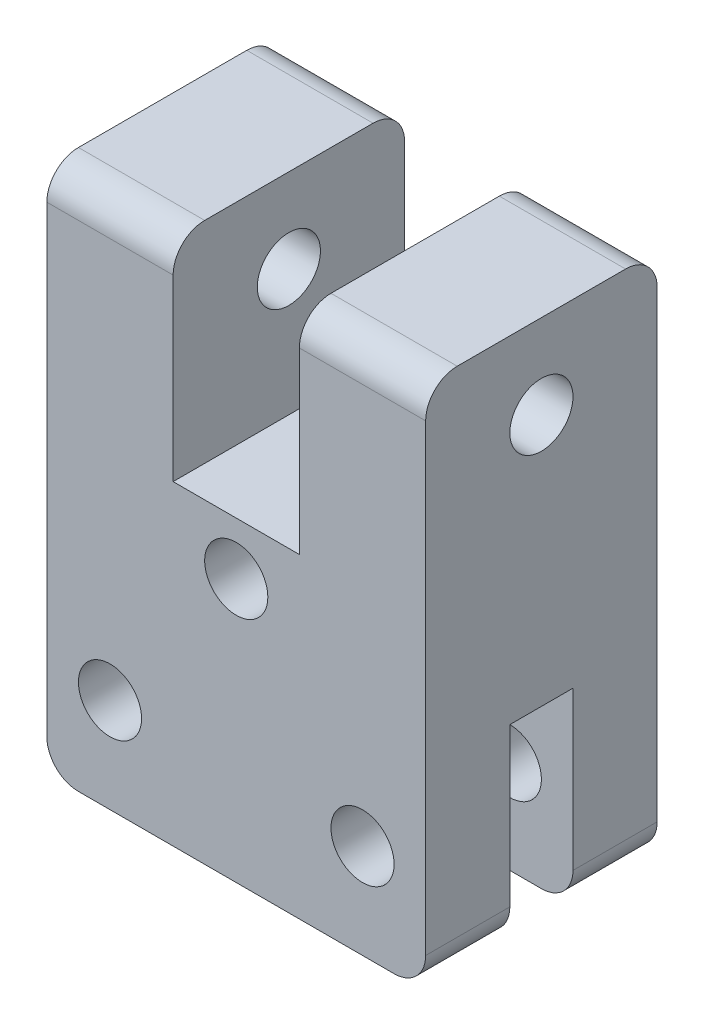
from build123d import *

# Parameters (mm, degrees)
CROQUIS2_W                 = 18
CROQUIS2_H                 = 15
SALIENTE_EXTRUIR1_DEPTH    = 5.5
CROQUIS3_W                 = 18
CROQUIS3_H                 = 9
CORTAR_EXTRUIR1_DEPTH      = 1.5
CORTAR_EXTRUIR2_DEPTH      = 13.942179106
CROQUIS10_W                = 6
CROQUIS10_H                = 11
SALIENTE_EXTRUIR4_DEPTH    = 10
CORTAR_EXTRUIR3_DEPTH      = 21.432816742
CORTAR_EXTRUIR3_DEPTH_BACK = 21.432816742
CROQUIS7_R                 = 1.5
CORTAR_EXTRUIR4_DEPTH      = 21.432816742
CORTAR_EXTRUIR4_DEPTH_BACK = 21.432816742
CROQUIS11_R                = 1.5
REDONDEO2_R                = 1.5
REDONDEO3_R                = 1.5
CROQUIS15_R                = 1.5
CORTAR_EXTRUIR7_DEPTH      = 10


with BuildPart() as part:
    # Croquis2 → Saliente-Extruir1 (new, symmetric)
    with BuildSketch(Plane.XY):
        Rectangle(CROQUIS2_W, CROQUIS2_H)
    extrude(amount=SALIENTE_EXTRUIR1_DEPTH, both=True)

    # Croquis3 → Cortar-Extruir1 (cut, symmetric)
    with BuildSketch(Plane.XY):
        with Locations((0, -3)):
            Rectangle(CROQUIS3_W, CROQUIS3_H)
    extrude(amount=CORTAR_EXTRUIR1_DEPTH, both=True, mode=Mode.SUBTRACT)

    # Croquis4 → Cortar-Extruir2 (cut, through all)
    with BuildSketch(Plane.XY):
        with BuildLine():
            Line((0.5, -1.5), (-0.5, -1.5))
            ThreePointArc((-0.5, -1.5), (-1.207106781, -1.792893219), (-1.5, -2.5))
            Line((-1.5, -2.5), (-1.5, -3))
            Line((-1.5, -3), (-1.5, -7.5))
            Line((-1.5, -7.5), (1.5, -7.5))
            Line((1.5, -7.5), (1.5, -3))
            Line((1.5, -3), (1.5, -2.5))
            ThreePointArc((1.5, -2.5), (1.207106781, -1.792893219), (0.5, -1.5))
        make_face()
    extrude(amount=-CORTAR_EXTRUIR2_DEPTH, mode=Mode.SUBTRACT)

    # Croquis10 → Saliente-Extruir4 (add)
    with BuildSketch(Plane(origin=(0, 7.5, 0), x_dir=(1, 0, 0), z_dir=(0, 1, 0))):
        with Locations((-6, 0)):
            Rectangle(CROQUIS10_W, CROQUIS10_H)
        with Locations((6, 0)):
            Rectangle(CROQUIS10_W, CROQUIS10_H)
    extrude(amount=SALIENTE_EXTRUIR4_DEPTH)

    # Croquis7 → Cortar-Extruir3 (cut, two sides: drawn at the far end of the back side and taken through both)
    with BuildSketch(Plane(origin=(0, 0, 0), x_dir=(0, 0, -1), z_dir=(1, 0, 0)).offset(-CORTAR_EXTRUIR3_DEPTH_BACK)):
        with Locations((0, 13.5)):
            Circle(CROQUIS7_R)
    extrude(amount=CORTAR_EXTRUIR3_DEPTH + CORTAR_EXTRUIR3_DEPTH_BACK, mode=Mode.SUBTRACT)

    # Croquis11 → Cortar-Extruir4 (cut, two sides: drawn at the far end of the back side and taken through both)
    with BuildSketch(Plane.XY.offset(-CORTAR_EXTRUIR4_DEPTH_BACK)):
        with Locations((6, -3)):
            Circle(CROQUIS11_R)
        with Locations((-6, -3)):
            Circle(CROQUIS11_R)
    extrude(amount=CORTAR_EXTRUIR4_DEPTH + CORTAR_EXTRUIR4_DEPTH_BACK, mode=Mode.SUBTRACT)

    # Redondeo2
    redondeo2_edges = [part.edges().sort_by_distance(p)[0] for p in [
        (6, 17.5, -5.5),
        (6, 17.5, 5.5),
        (-6, 17.5, 5.5),
        (-6, 17.5, -5.5),
    ]]
    fillet(redondeo2_edges, radius=REDONDEO2_R)

    # Redondeo3
    redondeo3_edges = [part.edges().sort_by_distance(p)[0] for p in [
        (9, -7.5, -3.5),
        (-9, -7.5, -3.5),
        (9, -7.5, 3.5),
        (-9, -7.5, 3.5),
    ]]
    fillet(redondeo3_edges, radius=REDONDEO3_R)

    # Croquis15 → Cortar-Extruir7 (cut)
    with BuildSketch(Plane.XY.offset(5.5)):
        with Locations((0, 5)):
            Circle(CROQUIS15_R)
    extrude(amount=-CORTAR_EXTRUIR7_DEPTH, mode=Mode.SUBTRACT)


solid = part.part
